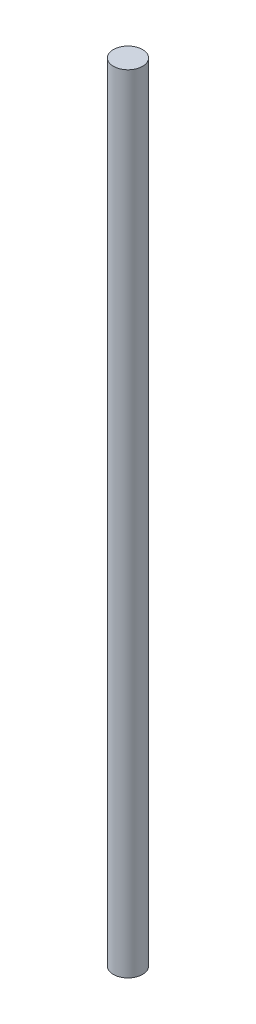
from build123d import *

# Parameters (mm, degrees)
SKETCH1_R           = 0.5
BOSS_EXTRUDE1_DEPTH = 27


with BuildPart() as part:
    # Sketch1 → Boss-Extrude1 (new body)
    with BuildSketch(Plane(origin=(0, 0, 0), x_dir=(1, 0, 0), z_dir=(0, 1, 0))):
        with Locations(Location((0, 0, 0), (0, 0, 270))):
            Circle(SKETCH1_R)
    extrude(amount=BOSS_EXTRUDE1_DEPTH)


solid = part.part
